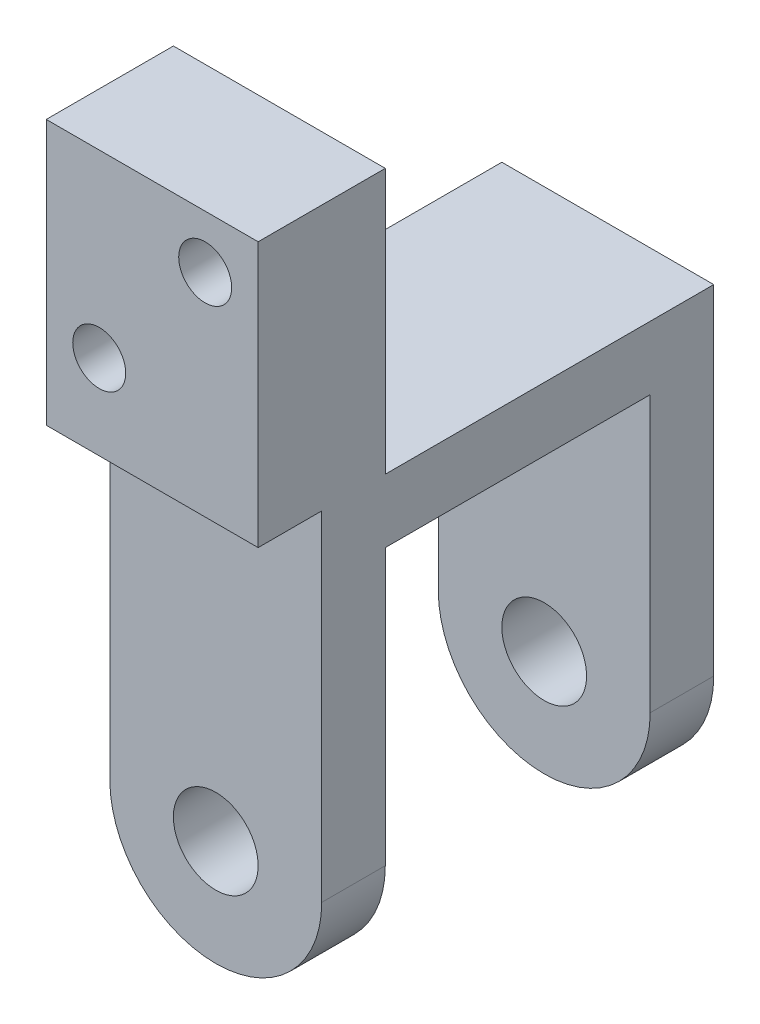
from build123d import *

# Parameters (mm, degrees)
EXTRUDE_1_DEPTH     = 37
SKETCH_5_R          = 4
CUT_EXTRUDE_1_DEPTH = 67.495686501
SKETCH_6_W          = 25
SKETCH_6_H          = 39.826286975
CUT_EXTRUDE_2_DEPTH = 52.661548552
SKETCH_8_W          = 20
SKETCH_8_H          = 25
EXTRUDE_5_DEPTH     = 6
SKETCH_8_3_W        = 20
SKETCH_8_3_H        = 25
EXTRUDE_6_DEPTH     = 6
SKETCH_10_W         = 20
SKETCH_10_H         = 25
EXTRUDE_7_DEPTH     = 6
SKETCH_11_R         = 2.5
CUT_EXTRUDE_3_DEPTH = 67.954199448


with BuildPart() as part:
    # 草图1 → 凸台-拉伸1 (new body)
    with BuildSketch(Plane.XY):
        with BuildLine():
            Line((-26.397852585, -19.99859328), (-26.397852585, 12.00140672))
            Line((-26.397852585, 12.00140672), (-46.397852585, 12.00140672))
            Line((-46.397852585, 12.00140672), (-46.397852585, -19.99859328))
            ThreePointArc((-46.397852585, -19.99859328), (-36.397852585, -29.99859328), (-26.397852585, -19.99859328))
        make_face()
    extrude(amount=EXTRUDE_1_DEPTH)

    # 草图5 → 切除-拉伸1 (cut, through all)
    with BuildSketch(Plane(origin=(0, 0, 0), x_dir=(-1, 0, 0), z_dir=(0, 0, -1))):
        with Locations((36.397852585, -19.99859328)):
            Circle(SKETCH_5_R)
    extrude(amount=-CUT_EXTRUDE_1_DEPTH, mode=Mode.SUBTRACT)

    # 草图6 → 切除-拉伸2 (cut, through all)
    with BuildSketch(Plane(origin=(-26.397852585, 0, 0), x_dir=(0, 0, -1), z_dir=(1, 0, 0))):
        with Locations((-18.5, -13.911736768)):
            Rectangle(SKETCH_6_W, SKETCH_6_H)
    extrude(amount=-CUT_EXTRUDE_2_DEPTH, mode=Mode.SUBTRACT)



with BuildPart() as body_2:
    # 草图8 → 凸台-拉伸5 (new body)
    with BuildSketch(Plane.XY.offset(37)):
        with Locations((-36.397852585, 24.50140672)):
            Rectangle(SKETCH_8_W, SKETCH_8_H)
    extrude(amount=EXTRUDE_5_DEPTH)

    # 草图8<3> → 凸台-拉伸6 (add)
    with BuildSketch(Plane.XY.offset(37)):
        with Locations((-36.397852585, 24.50140672)):
            Rectangle(SKETCH_8_3_W, SKETCH_8_3_H)
    extrude(amount=EXTRUDE_6_DEPTH)


with BuildPart() as part_1:
    add(part.part)

    add(body_2.part)  # 凸台-拉伸7 merges body 2
    # 草图10 → 凸台-拉伸7 (add)
    with BuildSketch(Plane(origin=(0, 0, 37), x_dir=(-1, 0, 0), z_dir=(0, 0, -1))):
        with Locations((36.397852585, 24.50140672)):
            Rectangle(SKETCH_10_W, SKETCH_10_H)
    extrude(amount=EXTRUDE_7_DEPTH)

    # 草图11 → 切除-拉伸3 (cut, through all)
    with BuildSketch(Plane(origin=(0, 0, 31), x_dir=(-1, 0, 0), z_dir=(0, 0, -1))):
        with Locations((31.397852585, 32.00140672)):
            Circle(SKETCH_11_R)
        with Locations((41.397852585, 20.00140672)):
            Circle(SKETCH_11_R)
    extrude(amount=-CUT_EXTRUDE_3_DEPTH, mode=Mode.SUBTRACT)


solid = part_1.part
